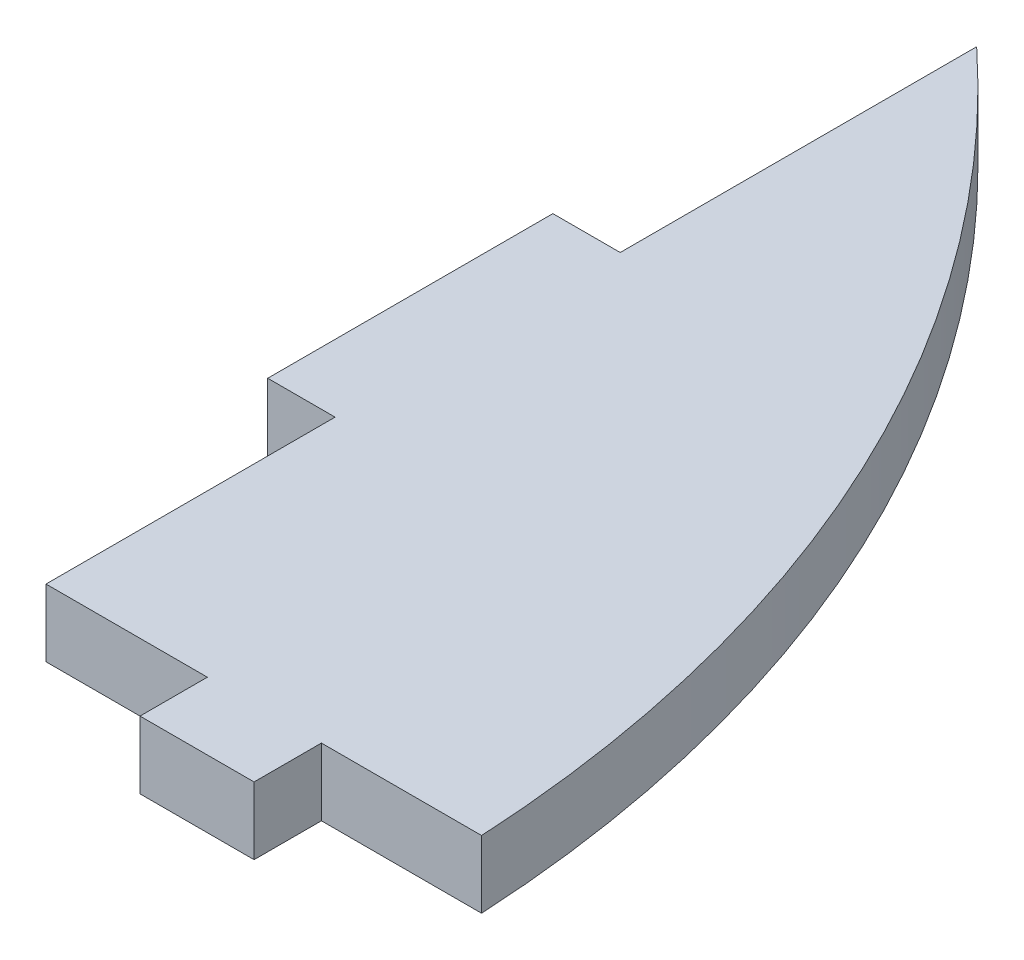
from build123d import *

# Parameters (mm, degrees)
BOSS_EXTRUDE1_DEPTH = 3


with BuildPart() as part:
    # Sketch2 → Boss-Extrude1 (new body)
    with BuildSketch(Plane(origin=(0, 0, 0), x_dir=(1, 0, 0), z_dir=(0, 1, 0))):
        with BuildLine():
            Line((0, 0), (0, 12.875))
            Line((0, 12.875), (-3, 12.875))
            Line((-3, 12.875), (-3, 25.575))
            Line((-3, 25.575), (0, 25.575))
            Line((0, 25.575), (0, 41.45))
            ThreePointArc((0, 41.45), (13.737406392, 22.614642557), (19.4, 0))
            Line((19.4, 0), (12.266745701, 0))
            Line((12.266745701, 0), (12.266745701, -3))
            Line((12.266745701, -3), (7.186745701, -3))
            Line((7.186745701, -3), (7.186745701, 0))
            Line((7.186745701, 0), (0, 0))
        make_face()
    extrude(amount=BOSS_EXTRUDE1_DEPTH)


solid = part.part
